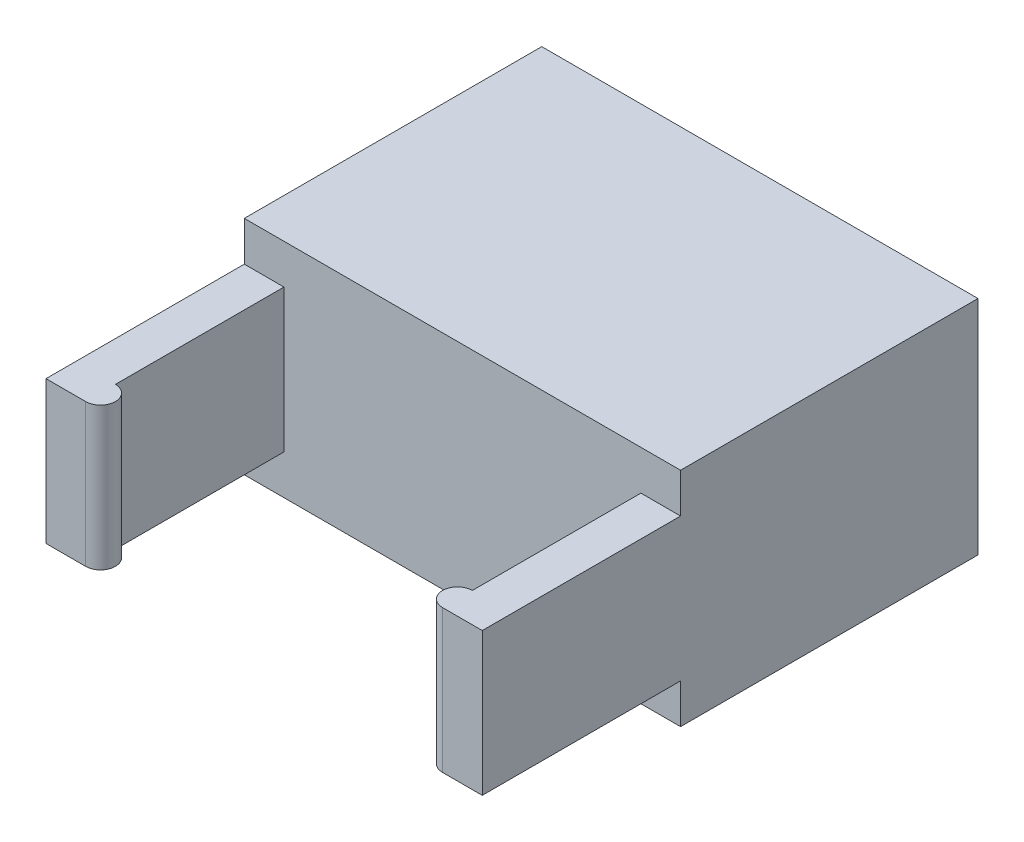
from build123d import *

# Parameters (mm, degrees)
SKETCH1_W           = 2
SKETCH1_H           = 7.2
SKETCH1_W_2         = 18
BOSS_EXTRUDE3_DEPTH = 15
BOSS_EXTRUDE4_START = 15
SKETCH1_4_W         = 2
SKETCH1_4_H         = 7.2
BOSS_EXTRUDE4_DEPTH = 8.5
BOSS_EXTRUDE5_START = -3.6
SKETCH3_W           = 2
SKETCH3_H           = 1.5
BOSS_EXTRUDE5_DEPTH = 7.2


with BuildPart() as part:
    # Sketch1 → Boss-Extrude3 (new body)
    with BuildSketch(Plane.XY):
        Polygon((9, 3.6), (11, 3.6), (11, 5.6), (-11, 5.6), (-11, 3.6), (-9, 3.6), align=None)
        with Locations((-10, 0)):
            Rectangle(SKETCH1_W, SKETCH1_H)
        Rectangle(SKETCH1_W_2, SKETCH1_H)
        Polygon((11, -3.6), (11, -5.6), (-11, -5.6), (-11, -3.6), (-9, -3.6), (9, -3.6), align=None)
        with Locations((10, 0)):
            Rectangle(SKETCH1_W, SKETCH1_H)
    extrude(amount=BOSS_EXTRUDE3_DEPTH)

    # Sketch1<4> → Boss-Extrude4 (add)
    with BuildSketch(Plane.XY.offset(BOSS_EXTRUDE4_START)):
        with Locations((-10, 0)):
            Rectangle(SKETCH1_4_W, SKETCH1_4_H)
        with Locations((10, 0)):
            Rectangle(SKETCH1_4_W, SKETCH1_4_H)
    extrude(amount=BOSS_EXTRUDE4_DEPTH)

    # Sketch3 → Boss-Extrude5 (add)
    with BuildSketch(Plane(origin=(0, 0, 0), x_dir=(1, 0, 0), z_dir=(0, 1, 0)).offset(BOSS_EXTRUDE5_START)):
        with Locations((-10, -24.25)):
            Rectangle(SKETCH3_W, SKETCH3_H)
        with BuildLine():
            Line((-9, -23.5), (-9, -25))
            ThreePointArc((-9, -25), (-8.25, -24.25), (-9, -23.5))
        make_face()
    boss_extrude5 = extrude(amount=BOSS_EXTRUDE5_DEPTH)

    # Mirror1: Boss-Extrude5 across plane
    add(boss_extrude5.mirror(Plane(origin=(0, 0, 0), x_dir=(0, 0, 1), z_dir=(1, 0, 0))))


solid = part.part
